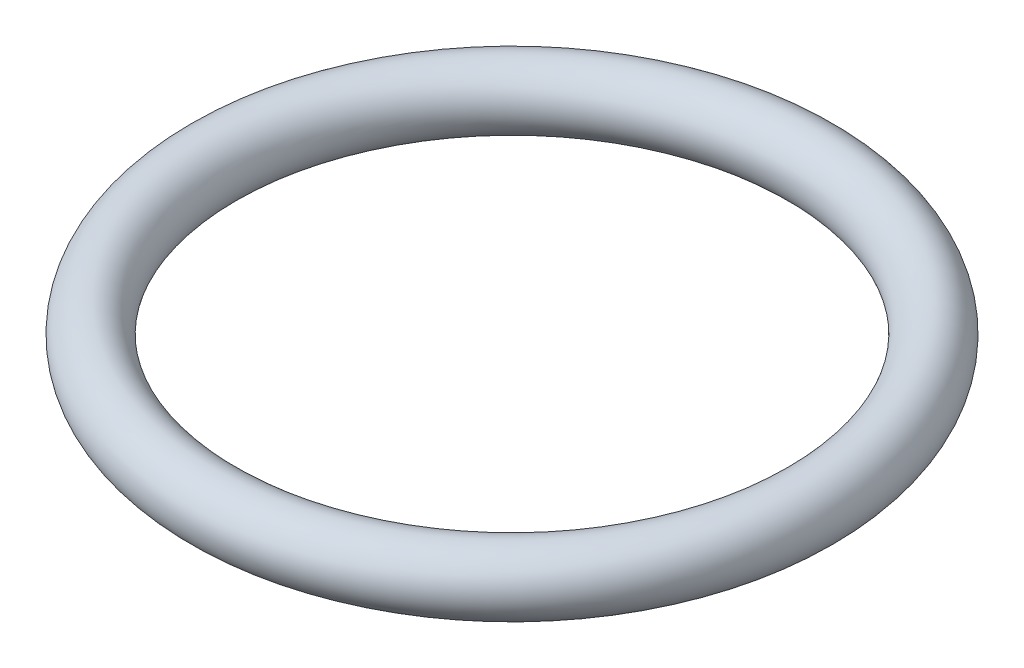
from build123d import *

# Parameters (mm, degrees)
SKE_R = 2.9


with BuildPart() as part:
    # Ske → Revolve 354 (revolve)
    with BuildSketch(Plane.XY, mode=Mode.PRIVATE) as revolve_354_sk:
        with Locations((27.4, 0)):
            Circle(SKE_R)
    revolve(revolve_354_sk.sketch.rotate(Axis((0, 9.409969387, 0), (0, -1, 0)), 180), axis=Axis((0, 9.409969387, 0), (0, -1, 0)))


solid = part.part
